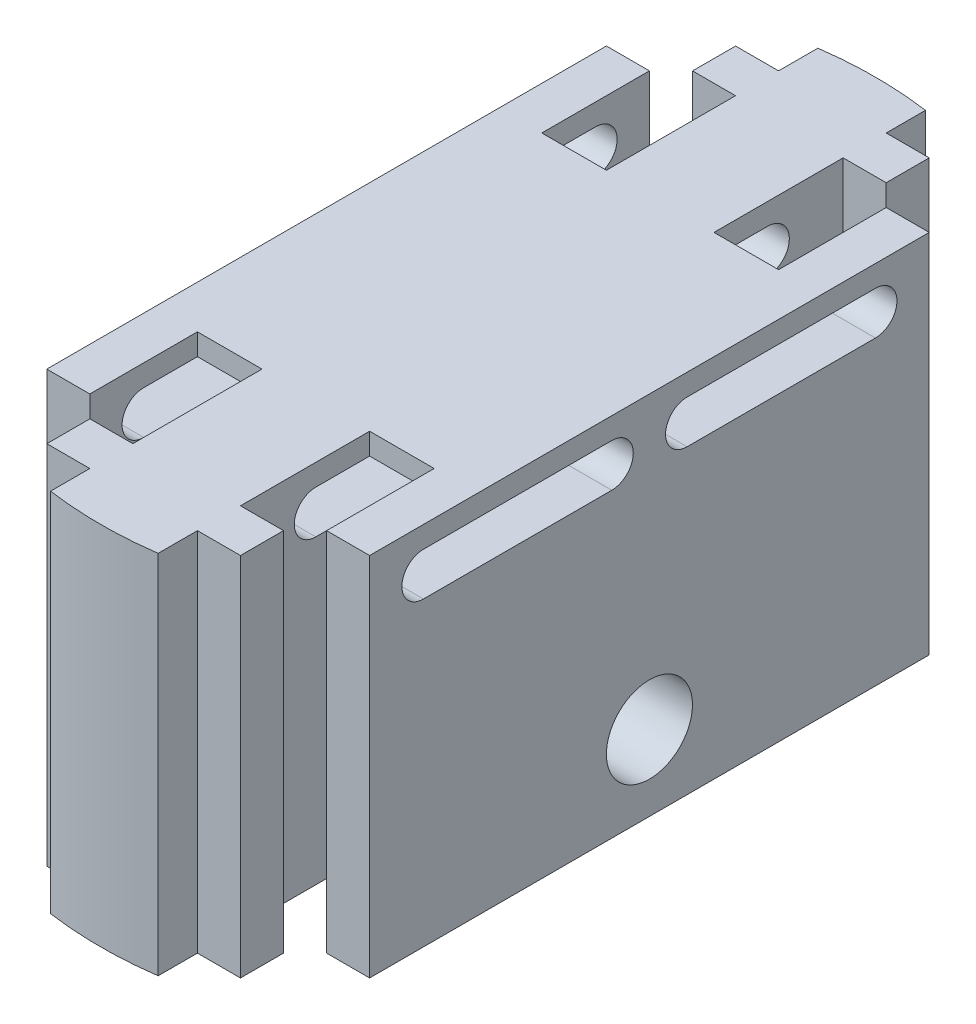
from build123d import *

# Parameters (mm, degrees)
EXTRUDE_7_DEPTH          = 7
EXTRUDE_START            = 7
SKETCH_11_W              = 5
SKETCH_11_H              = 16
EXTRUDE_8_DEPTH          = 10
EXTRUDE_10_DEPTH         = 17
CUT_EXTRUDE_1_DEPTH      = 26.869866641
CUT_EXTRUDE_1_DEPTH_BACK = 26.869866641
SKETCH_15_R              = 2
CUT_EXTRUDE_2_DEPTH      = 26.869866641
CUT_EXTRUDE_2_DEPTH_BACK = 26.869866641


with BuildPart() as part:
    # 草图8 → 凸台-拉伸7 (new body)
    with BuildSketch(Plane(origin=(0, 0, 0), x_dir=(1, 0, 0), z_dir=(0, 1, 0))):
        with BuildLine():
            Line((4.5, -16), (2.5, -16))
            Line((2.5, -16), (2.5, -17.82554347))
            ThreePointArc((2.5, -17.82554347), (0, -18), (-2.5, -17.82554347))
            Line((-2.5, -17.82554347), (-2.5, -16))
            Line((-2.5, -16), (-4.49639369, -16))
            Line((-4.49639369, -16), (-4.49639369, -14))
            Line((-4.49639369, -14), (-2.5, -14))
            Line((-2.5, -14), (-2.5, -13))
            Line((-2.5, -13), (-2.5, 13))
            Line((-2.5, 13), (-2.5, 14))
            Line((-2.5, 14), (-4.49639369, 14))
            Line((-4.49639369, 14), (-4.49639369, 16))
            Line((-4.49639369, 16), (-2.5, 16))
            Line((-2.5, 16), (-2.5, 17.82554347))
            ThreePointArc((-2.5, 17.82554347), (0, 18), (2.5, 17.82554347))
            Line((2.5, 17.82554347), (2.5, 16))
            Line((2.5, 16), (4.5, 16))
            Line((4.5, 16), (4.5, 14))
            Line((4.5, 14), (2.5, 14))
            Line((2.5, 14), (2.5, 13))
            Line((2.5, 13), (2.5, -13))
            Line((2.5, -13), (2.5, -14))
            Line((2.5, -14), (4.5, -14))
            Line((4.5, -14), (4.5, -16))
        make_face()
    extrude(amount=EXTRUDE_7_DEPTH)

    # 草图11 → 凸台-拉伸8 (add)
    with BuildSketch(Plane(origin=(0, 0, 0), x_dir=(1, 0, 0), z_dir=(0, 1, 0)).offset(EXTRUDE_START)):
        Rectangle(SKETCH_11_W, SKETCH_11_H)
    extrude(amount=EXTRUDE_8_DEPTH)

    # 草图14 → 凸台-拉伸10 (add)
    with BuildSketch(Plane(origin=(0, 0, 0), x_dir=(1, 0, 0), z_dir=(0, 1, 0))):
        with BuildLine():
            ThreePointArc((-2.5, -17.82554347), (-1.253039812, -17.9563329), (0, -18))
            Line((0, -18), (0, 18))
            ThreePointArc((0, 18), (-1.253039812, 17.9563329), (-2.5, 17.82554347))
            Line((-2.5, 17.82554347), (-2.5, 16))
            Line((-2.5, 16), (-4.49639369, 16))
            Line((-4.49639369, 16), (-4.49639369, 14))
            Line((-4.49639369, 14), (-2.5, 14))
            Line((-2.5, 14), (-2.5, 8))
            Line((-2.5, 8), (-5.5, 8))
            Line((-5.5, 8), (-5.5, 13))
            Line((-5.5, 13), (-7.5, 13))
            Line((-7.5, 13), (-7.5, -13))
            Line((-7.5, -13), (-5.5, -13))
            Line((-5.5, -13), (-5.5, -8))
            Line((-5.5, -8), (-2.5, -8))
            Line((-2.5, -8), (-2.5, -14))
            Line((-2.5, -14), (-4.49639369, -14))
            Line((-4.49639369, -14), (-4.49639369, -16))
            Line((-4.49639369, -16), (-2.5, -16))
            Line((-2.5, -16), (-2.5, -17.82554347))
        make_face()
        with BuildLine():
            Line((4.5, -14), (2.5, -14))
            Line((2.5, -14), (2.5, -8))
            Line((2.5, -8), (5.5, -8))
            Line((5.5, -8), (5.5, -13))
            Line((5.5, -13), (7.5, -13))
            Line((7.5, -13), (7.5, 13))
            Line((7.5, 13), (5.5, 13))
            Line((5.5, 13), (5.5, 8))
            Line((5.5, 8), (2.5, 8))
            Line((2.5, 8), (2.5, 14))
            Line((2.5, 14), (4.5, 14))
            Line((4.5, 14), (4.5, 16))
            Line((4.5, 16), (2.5, 16))
            Line((2.5, 16), (2.5, 17.82554347))
            ThreePointArc((2.5, 17.82554347), (1.253039812, 17.9563329), (0, 18))
            Line((0, 18), (0, -18))
            ThreePointArc((0, -18), (1.253039812, -17.9563329), (2.5, -17.82554347))
            Line((2.5, -17.82554347), (2.5, -16))
            Line((2.5, -16), (4.5, -16))
            Line((4.5, -16), (4.5, -14))
        make_face()
    extrude(amount=EXTRUDE_10_DEPTH)

    # 草图15 → 切除-拉伸1 (cut, two sides: drawn at the far end of the back side and taken through both)
    with BuildSketch(Plane(origin=(0, 0, 0), x_dir=(0, 0, -1), z_dir=(1, 0, 0)).offset(-CUT_EXTRUDE_1_DEPTH_BACK)):
        with Locations((0, 3.5)):
            Circle(SKETCH_15_R)
    extrude(amount=CUT_EXTRUDE_1_DEPTH + CUT_EXTRUDE_1_DEPTH_BACK, mode=Mode.SUBTRACT)

    # 草图17 → 切除-拉伸2 (cut, two sides: drawn at the far end of the back side and taken through both)
    with BuildSketch(Plane(origin=(0, 0, 0), x_dir=(0, 0, -1), z_dir=(1, 0, 0)).offset(-CUT_EXTRUDE_2_DEPTH_BACK)):
        with BuildLine():
            Line((-10.5, 16), (-1.75, 16))
            ThreePointArc((-1.75, 16), (-0.75, 15), (-1.75, 14))
            Line((-1.75, 14), (-10.5, 14))
            ThreePointArc((-10.5, 14), (-11.5, 15), (-10.5, 16))
        make_face()
        with BuildLine():
            Line((1.75, 14), (10.5, 14))
            ThreePointArc((10.5, 14), (11.5, 15), (10.5, 16))
            Line((10.5, 16), (1.75, 16))
            ThreePointArc((1.75, 16), (0.75, 15), (1.75, 14))
        make_face()
    extrude(amount=CUT_EXTRUDE_2_DEPTH + CUT_EXTRUDE_2_DEPTH_BACK, mode=Mode.SUBTRACT)


solid = part.part
